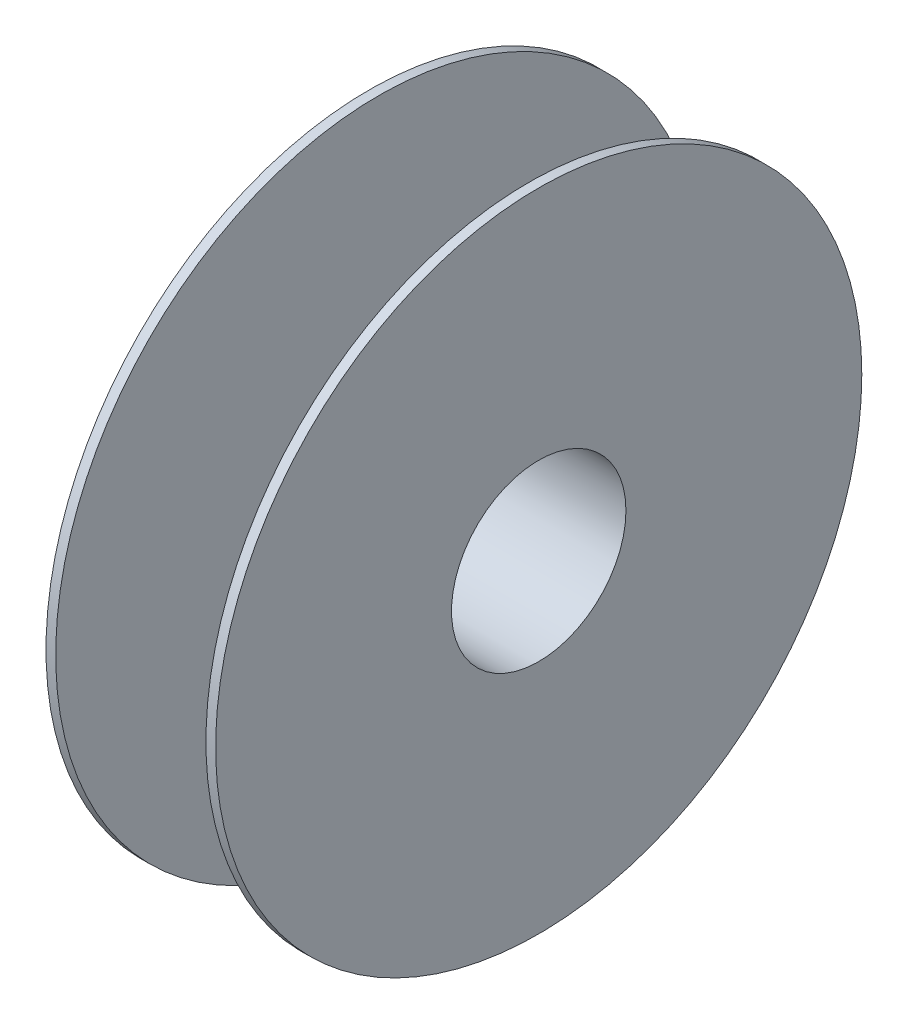
from build123d import *


with BuildPart() as part:
    # Sketch1 → Revolve1 (revolve)
    with BuildSketch(Plane.XY, mode=Mode.PRIVATE) as revolve1_sk:
        Polygon((-26.25, 27), (-26.25, 100), (-23.25, 100), (-23.25, 30), (23.25, 30), (23.25, 100), (26.25, 100), (26.25, 27), align=None)
    revolve(revolve1_sk.sketch.rotate(Axis((0, 0, 0), (-1, 0, 0)), 90), axis=Axis((0, 0, 0), (-1, 0, 0)))


solid = part.part
